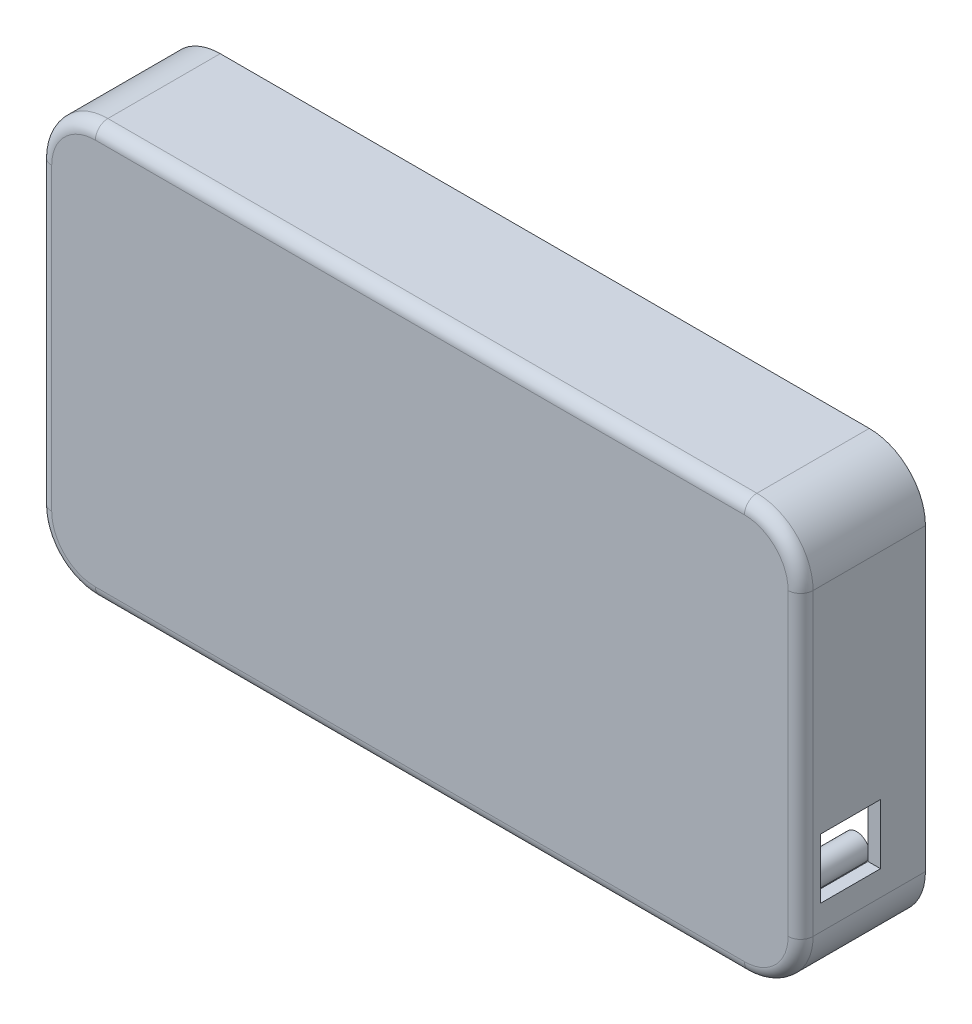
from build123d import *

# Parameters (mm, degrees)
EXTRUDE_1_DEPTH      = 50
SKETCH_1_4_R         = 5.1
CUT_EXTRUDE_1_DEPTH  = 45
CUT_EXTRUDE_2_DEPTH  = 5
SKETCH_1_6_R         = 5.1
CUT_EXTRUDE_3_DEPTH  = 5
SKETCH_1_7_R         = 2.6
CUT_EXTRUDE_4_DEPTH  = 25
FILLET_2_R           = 5
SKETCH_14_W          = 14
SKETCH_14_H          = 9
SKETCH_14_R          = 1.6
USB_DEPTH            = 5
SKETCH_16_W          = 24
SKETCH_16_H          = 24
CUT_EXTRUDE_12_DEPTH = 5
SKETCH_18_W          = 24
SKETCH_18_H          = 24
CUT_EXTRUDE_13_DEPTH = 5
EXTRUDE_2_DEPTH      = 40
EXTRUDE_3_DEPTH      = 2
SKETCH_29_4_R        = 2.95
SKETCH_29_4_R_2      = 1.25
EXTRUDE_4_DEPTH      = 5
SKETCH_29_5_R        = 3.3
SKETCH_29_5_R_2      = 1.3
EXTRUDE_5_DEPTH      = 6.5


with BuildPart() as part:
    # 草图1 → 凸台-拉伸1 (new body)
    with BuildSketch(Plane.XY):
        with BuildLine():
            Line((-130, 82.5), (130, 82.5))
            ThreePointArc((130, 82.5), (145.909902577, 75.909902577), (152.5, 60))
            Line((152.5, 60), (152.5, -60))
            ThreePointArc((152.5, -60), (145.909902577, -75.909902577), (130, -82.5))
            Line((130, -82.5), (-130, -82.5))
            ThreePointArc((-130, -82.5), (-145.909902577, -75.909902577), (-152.5, -60))
            Line((-152.5, -60), (-152.5, 60))
            ThreePointArc((-152.5, 60), (-145.909902577, 75.909902577), (-130, 82.5))
        make_face()
    extrude(amount=EXTRUDE_1_DEPTH)

    # 草图1<4> → 切除-拉伸1 (cut)
    with BuildSketch(Plane.XY):
        with BuildLine():
            Line((130, 77.5), (-130, 77.5))
            ThreePointArc((-130, 77.5), (-142.374368671, 72.374368671), (-147.5, 60))
            Line((-147.5, 60), (-147.5, -60))
            ThreePointArc((-147.5, -60), (-142.374368671, -72.374368671), (-130, -77.5))
            Line((-130, -77.5), (130, -77.5))
            ThreePointArc((130, -77.5), (142.374368671, -72.374368671), (147.5, -60))
            Line((147.5, -60), (147.5, 60))
            ThreePointArc((147.5, 60), (142.374368671, 72.374368671), (130, 77.5))
        make_face()
        with Locations((-130, -60)):
            Circle(SKETCH_1_4_R, mode=Mode.SUBTRACT)
        with Locations((130, -60)):
            Circle(SKETCH_1_4_R, mode=Mode.SUBTRACT)
        with Locations((-130, 60)):
            Circle(SKETCH_1_4_R, mode=Mode.SUBTRACT)
        with Locations((130, 60)):
            Circle(SKETCH_1_4_R, mode=Mode.SUBTRACT)
    extrude(amount=CUT_EXTRUDE_1_DEPTH, mode=Mode.SUBTRACT)

    # 草图1<5> → 切除-拉伸2 (cut)
    with BuildSketch(Plane.XY):
        with BuildLine():
            ThreePointArc((-130, 80.2), (-144.28355698, 74.28355698), (-150.2, 60))
            Line((-150.2, 60), (-150.2, -60))
            ThreePointArc((-150.2, -60), (-144.28355698, -74.28355698), (-130, -80.2))
            Line((-130, -80.2), (130, -80.2))
            ThreePointArc((130, -80.2), (144.28355698, -74.28355698), (150.2, -60))
            Line((150.2, -60), (150.2, 60))
            ThreePointArc((150.2, 60), (144.28355698, 74.28355698), (130, 80.2))
            Line((130, 80.2), (-130, 80.2))
        make_face()
        with BuildLine():
            ThreePointArc((-147.5, 60), (-142.374368671, 72.374368671), (-130, 77.5))
            Line((-130, 77.5), (130, 77.5))
            ThreePointArc((130, 77.5), (142.374368671, 72.374368671), (147.5, 60))
            Line((147.5, 60), (147.5, -60))
            ThreePointArc((147.5, -60), (142.374368671, -72.374368671), (130, -77.5))
            Line((130, -77.5), (-130, -77.5))
            ThreePointArc((-130, -77.5), (-142.374368671, -72.374368671), (-147.5, -60))
            Line((-147.5, -60), (-147.5, 60))
        make_face(mode=Mode.SUBTRACT)
    extrude(amount=CUT_EXTRUDE_2_DEPTH, mode=Mode.SUBTRACT)

    # 草图1<6> → 切除-拉伸3 (cut)
    with BuildSketch(Plane.XY):
        with Locations((130, 60)):
            Circle(SKETCH_1_6_R)
        with Locations((130, -60)):
            Circle(SKETCH_1_6_R)
        with Locations((-130, 60)):
            Circle(SKETCH_1_6_R)
        with Locations((-130, -60)):
            Circle(SKETCH_1_6_R)
    extrude(amount=CUT_EXTRUDE_3_DEPTH, mode=Mode.SUBTRACT)

    # 草图1<7> → 切除-拉伸4 (cut)
    with BuildSketch(Plane.XY):
        with Locations((130, 60)):
            Circle(SKETCH_1_7_R)
        with Locations((130, -60)):
            Circle(SKETCH_1_7_R)
        with Locations((-130, 60)):
            Circle(SKETCH_1_7_R)
        with Locations((-130, -60)):
            Circle(SKETCH_1_7_R)
    extrude(amount=CUT_EXTRUDE_4_DEPTH, mode=Mode.SUBTRACT)

    # 圆角2
    fillet_2_edges = [part.edges().sort_by_distance(p)[0] for p in [
        (0, -82.5, 50),
        (152.5, 0, 50),
        (0, 82.5, 50),
        (-152.5, 0, 50),
    ]]
    fillet(fillet_2_edges, radius=FILLET_2_R)

    # 草图14 → USB口 (cut)
    with BuildSketch(Plane.XZ.offset(82.5)):
        with Locations((-80, 38)):
            Rectangle(SKETCH_14_W, SKETCH_14_H)
        with Locations((-71, 38)):
            Circle(SKETCH_14_R)
        with Locations((-89, 38)):
            Circle(SKETCH_14_R)
    extrude(amount=-USB_DEPTH, mode=Mode.SUBTRACT)

    # 草图16 → 切除-拉伸12 (cut)
    with BuildSketch(Plane(origin=(152.5, 0, 0), x_dir=(0, 0, -1), z_dir=(1, 0, 0))):
        with Locations((-30, -38)):
            Rectangle(SKETCH_16_W, SKETCH_16_H)
    extrude(amount=-CUT_EXTRUDE_12_DEPTH, mode=Mode.SUBTRACT)

    # 草图18 → 切除-拉伸13 (cut)
    with BuildSketch(Plane.ZY.offset(152.5)):
        with Locations((30, -38)):
            Rectangle(SKETCH_18_W, SKETCH_18_H)
    extrude(amount=-CUT_EXTRUDE_13_DEPTH, mode=Mode.SUBTRACT)

    # 草图19 → 凸台-拉伸2 (add)
    with BuildSketch(Plane(origin=(0, 0, 45), x_dir=(-1, 0, 0), z_dir=(0, 0, -1))):
        with BuildLine():
            Line((-103, 40), (-18, 40))
            ThreePointArc((-18, 40), (-14, 36), (-18, 32))
            Line((-18, 32), (-103, 32))
            ThreePointArc((-103, 32), (-107, 36), (-103, 40))
        make_face()
        with BuildLine():
            Line((103, 40), (18, 40))
            ThreePointArc((18, 40), (14, 36), (18, 32))
            Line((18, 32), (103, 32))
            ThreePointArc((103, 32), (107, 36), (103, 40))
        make_face()
        with BuildLine():
            Line((-103, -20), (-23, -20))
            ThreePointArc((-23, -20), (-19, -24), (-23, -28))
            Line((-23, -28), (-103, -28))
            ThreePointArc((-103, -28), (-107, -24), (-103, -20))
        make_face()
        with BuildLine():
            Line((103, -20), (23, -20))
            ThreePointArc((23, -20), (19, -24), (23, -28))
            Line((23, -28), (103, -28))
            ThreePointArc((103, -28), (107, -24), (103, -20))
        make_face()
    extrude(amount=EXTRUDE_2_DEPTH)

    # 草图29 → 凸台-拉伸3 (add)
    with BuildSketch(Plane(origin=(0, 0, 45), x_dir=(-1, 0, 0), z_dir=(0, 0, -1))):
        Polygon((-14.35, -45.2), (14.35, -45.2), (14.35, -18.5), (12.85, -18.5), (12.85, -20), (12.85, -43.7), (-12.85, -43.7), (-12.85, -20), (-12.85, -18.5), (-14.35, -18.5), align=None)
    extrude(amount=EXTRUDE_3_DEPTH)

    # 草图29<4> → 凸台-拉伸4 (add)
    # profile 1 of 2: a face of its own
    with BuildSketch(Plane(origin=(0, 0, 45), x_dir=(-1, 0, 0), z_dir=(0, 0, -1))):
        with Locations((-17.5, -31.85)):
            Circle(SKETCH_29_4_R)
        with Locations((-17.5, -31.85)):
            Circle(SKETCH_29_4_R_2, mode=Mode.SUBTRACT)
    # profile 2 of 2: a face of its own
    with BuildSketch(Plane(origin=(0, 0, 45), x_dir=(-1, 0, 0), z_dir=(0, 0, -1))):
        with Locations((17.5, -31.85)):
            Circle(SKETCH_29_4_R)
        with Locations((17.5, -31.85)):
            Circle(SKETCH_29_4_R_2, mode=Mode.SUBTRACT)
    extrude(amount=EXTRUDE_4_DEPTH)

    # 草图29<5> → 凸台-拉伸5 (add)
    # profile 1 of 4: a face of its own
    with BuildSketch(Plane(origin=(0, 0, 45), x_dir=(-1, 0, 0), z_dir=(0, 0, -1))):
        with Locations((-30, 20)):
            Circle(SKETCH_29_5_R)
        with Locations((-30, 20)):
            Circle(SKETCH_29_5_R_2, mode=Mode.SUBTRACT)
    # profile 2 of 4: a face of its own
    with BuildSketch(Plane(origin=(0, 0, 45), x_dir=(-1, 0, 0), z_dir=(0, 0, -1))):
        with Locations((30, 20)):
            Circle(SKETCH_29_5_R)
        with Locations((30, 20)):
            Circle(SKETCH_29_5_R_2, mode=Mode.SUBTRACT)
    # profile 3 of 4: a face of its own
    with BuildSketch(Plane(origin=(0, 0, 45), x_dir=(-1, 0, 0), z_dir=(0, 0, -1))):
        with Locations((30, -10)):
            Circle(SKETCH_29_5_R)
        with Locations((30, -10)):
            Circle(SKETCH_29_5_R_2, mode=Mode.SUBTRACT)
    # profile 4 of 4: a face of its own
    with BuildSketch(Plane(origin=(0, 0, 45), x_dir=(-1, 0, 0), z_dir=(0, 0, -1))):
        with Locations((-30, -10)):
            Circle(SKETCH_29_5_R)
        with Locations((-30, -10)):
            Circle(SKETCH_29_5_R_2, mode=Mode.SUBTRACT)
    extrude(amount=EXTRUDE_5_DEPTH)


solid = part.part
